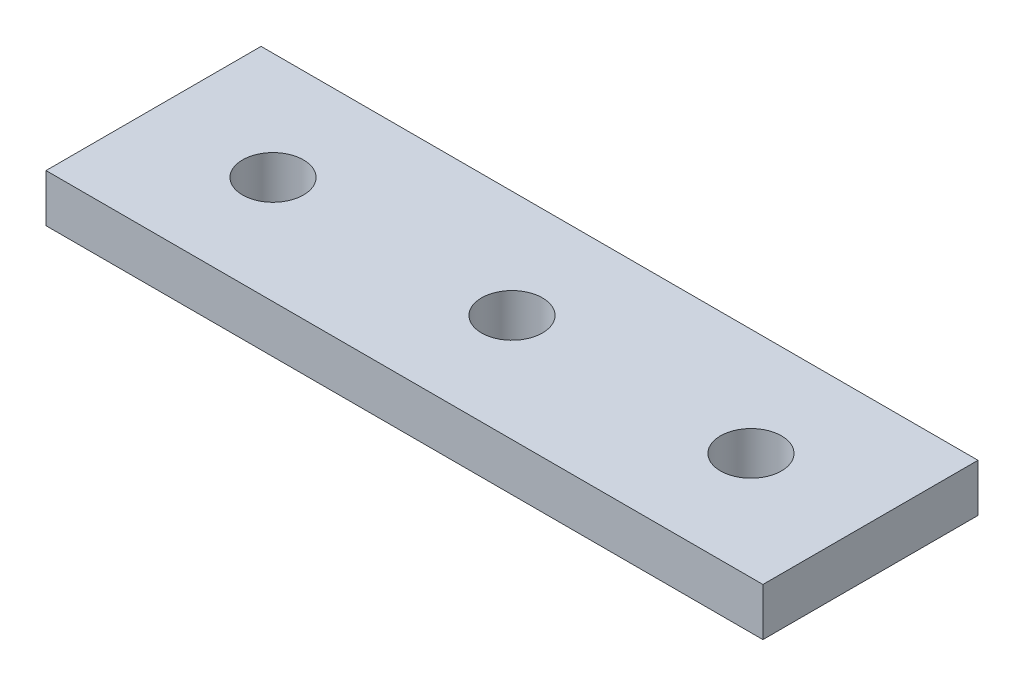
from build123d import *

# Parameters (mm, degrees)
SKETCH1_W           = 60
SKETCH1_H           = 18
SKETCH1_R           = 2.55
BOSS_EXTRUDE1_DEPTH = 4


with BuildPart() as part:
    # Sketch1 → Boss-Extrude1 (new body)
    with BuildSketch(Plane(origin=(0, 0, 0), x_dir=(1, 0, 0), z_dir=(0, 1, 0))):
        Rectangle(SKETCH1_W, SKETCH1_H)
        with Locations(Location((-20, 0, 0), (0, 0, 270))):
            Circle(SKETCH1_R, mode=Mode.SUBTRACT)
        with Locations(Location((20, 0, 0), (0, 0, 90))):
            Circle(SKETCH1_R, mode=Mode.SUBTRACT)
        with Locations(Location((0, 0, 0), (0, 0, 270))):
            Circle(SKETCH1_R, mode=Mode.SUBTRACT)
    extrude(amount=BOSS_EXTRUDE1_DEPTH)


solid = part.part
